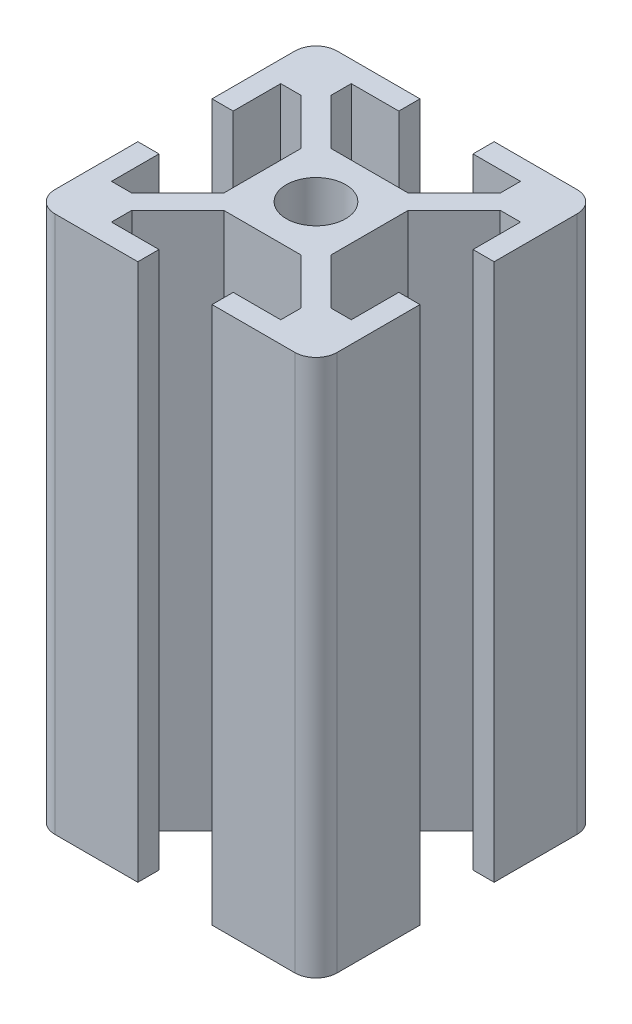
from build123d import *

# Parameters (mm, degrees)
BOSS_EXTRUDE1_DEPTH     = 19.05
CUT_EXTRUDE5_DEPTH      = 24.725566379
CUT_EXTRUDE5_DEPTH_BACK = 24.725566379
SKETCH5_R               = 2.1
CUT_EXTRUDE6_DEPTH      = 13
CUT_EXTRUDE7_START      = -13
SKETCH4_R               = 2.1
CUT_EXTRUDE7_DEPTH      = 13


with BuildPart() as part:
    # Sketch1 → Boss-Extrude1 (new, symmetric)
    with BuildSketch(Plane(origin=(0, 0, 0), x_dir=(1, 0, 0), z_dir=(0, 1, 0))):
        with BuildLine():
            Line((-8.5, -10), (8.5, -10))
            ThreePointArc((8.5, -10), (9.560660172, -9.560660172), (10, -8.5))
            Line((10, -8.5), (10, 8.5))
            ThreePointArc((10, 8.5), (9.560660172, 9.560660172), (8.5, 10))
            Line((8.5, 10), (-8.5, 10))
            ThreePointArc((-8.5, 10), (-9.560660172, 9.560660172), (-10, 8.5))
            Line((-10, 8.5), (-10, -8.5))
            ThreePointArc((-10, -8.5), (-9.560660172, -9.560660172), (-8.5, -10))
        make_face()
    extrude(amount=BOSS_EXTRUDE1_DEPTH, both=True)

    # Sketch3 → Cut-Extrude5 (cut, two sides: drawn at the far end of the back side and taken through both)
    with BuildSketch(Plane(origin=(0, 0, 0), x_dir=(1, 0, 0), z_dir=(0, 1, 0)).offset(-CUT_EXTRUDE5_DEPTH_BACK)):
        Polygon((2.63, 10), (-2.63, 10), (-2.63, 8.5), (-6, 8.5), (-6, 7.060660172), (-2.739339828, 3.8), (2.739339828, 3.8), (6, 7.060660172), (6, 8.5), (2.63, 8.5), align=None)
        Polygon((10, -2.63), (10, 2.63), (8.5, 2.63), (8.5, 6), (7.060660172, 6), (3.8, 2.739339828), (3.8, -2.739339828), (7.060660172, -6), (8.5, -6), (8.5, -2.63), align=None)
        Polygon((-2.63, -10), (2.63, -10), (2.63, -8.5), (6, -8.5), (6, -7.060660172), (2.739339828, -3.8), (-2.739339828, -3.8), (-6, -7.060660172), (-6, -8.5), (-2.63, -8.5), align=None)
        Polygon((-10, 2.63), (-10, -2.63), (-8.5, -2.63), (-8.5, -6), (-7.060660172, -6), (-3.8, -2.739339828), (-3.8, 2.739339828), (-7.060660172, 6), (-8.5, 6), (-8.5, 2.63), align=None)
    extrude(amount=CUT_EXTRUDE5_DEPTH + CUT_EXTRUDE5_DEPTH_BACK, mode=Mode.SUBTRACT)

    # Sketch5 → Cut-Extrude6 (cut)
    with BuildSketch(Plane.XZ.offset(19.05)):
        with Locations(Location((0, 0, 0), (0, 0, 270))):
            Circle(SKETCH5_R)
    extrude(amount=-CUT_EXTRUDE6_DEPTH, mode=Mode.SUBTRACT)

    # Sketch4 → Cut-Extrude7 (cut)
    with BuildSketch(Plane(origin=(0, 19.05, 0), x_dir=(1, 0, 0), z_dir=(0, 1, 0)).offset(CUT_EXTRUDE7_START)):
        with Locations(Location((0, 0, 0), (0, 0, 90))):
            Circle(SKETCH4_R)
    extrude(amount=CUT_EXTRUDE7_DEPTH, mode=Mode.SUBTRACT)


solid = part.part
